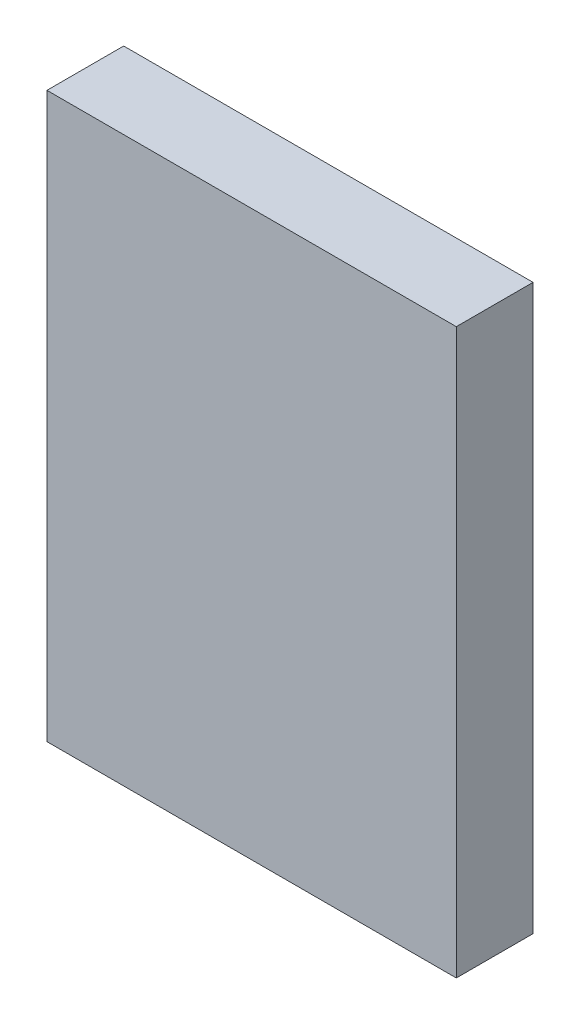
from build123d import *

# Parameters (mm, degrees)
CROQUIS1_W              = 50.8
CROQUIS1_H              = 70
SALIENTE_EXTRUIR1_DEPTH = 9.525


with BuildPart() as part:
    # Croquis1 → Saliente-Extruir1 (new body)
    with BuildSketch(Plane.XY):
        Rectangle(CROQUIS1_W, CROQUIS1_H)
    extrude(amount=SALIENTE_EXTRUIR1_DEPTH)


solid = part.part
